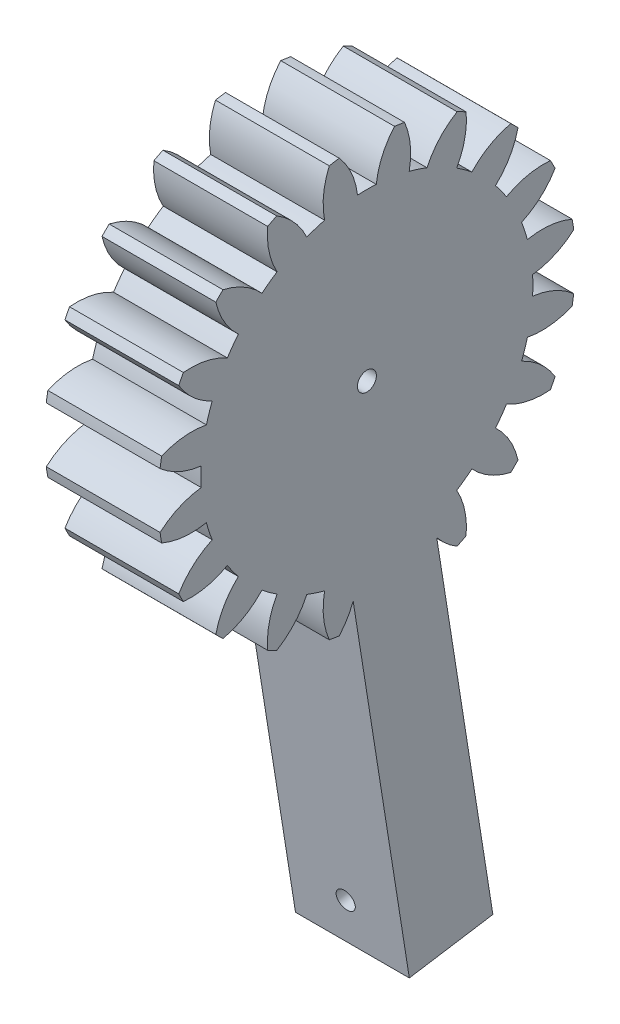
from build123d import *

# Parameters (mm, degrees)
BASPROSKE_W              = 30
BASPROSKE_H              = 55
TOOTHCUT_DEPTH           = 84.366660003
TEETHCUTS_COUNT          = 20
BORSKE_R                 = 2.5
BORE_DEPTH               = 50.0000508
EXTRUDE_1_DEPTH          = 30
CUT_EXTRUDE_1_DEPTH      = 158.555338193
CUT_EXTRUDE_1_DEPTH_BACK = 158.555338193
SKETCH_7_R               = 2.5


with BuildPart() as part:
    # BasProSke → Base-Revolve (revolve)
    with BuildSketch(Plane(origin=(0, 0, 0), x_dir=(1, 0, 0), z_dir=(0, 1, 0)), mode=Mode.PRIVATE) as base_revolve_sk:
        with Locations((15, 27.5)):
            Rectangle(BASPROSKE_W, BASPROSKE_H)
    revolve(base_revolve_sk.sketch.rotate(Axis((-10, 0, 0), (1, 0, 0)), 180), axis=Axis((-10, 0, 0), (1, 0, 0)))

    # TooCutSke → ToothCut (cut, through all)
    with BuildSketch(Plane(origin=(0, 0, 0), x_dir=(0, 0, -1), z_dir=(1, 0, 0))):
        with BuildLine():
            ThreePointArc((2.464838288, 43.679509764), (0, 43.749), (-2.464838288, 43.679509764))
            ThreePointArc((-2.464838288, 43.679509764), (-4.057398861, 49.476814676), (-7.300899231, 54.538899105))
            ThreePointArc((-7.300899231, 54.538899105), (0, 55.0254), (7.300899231, 54.538899105))
            ThreePointArc((7.300899231, 54.538899105), (4.057398861, 49.476814676), (2.464838288, 43.679509764))
        make_face()
    toothcut = extrude(amount=TOOTHCUT_DEPTH, mode=Mode.SUBTRACT)

    # TeethCuts: ToothCut ×20 about axis
    teethcuts_axis = Axis((0, 0, 0), (1, 0, 0))
    for i in range(1, TEETHCUTS_COUNT):
        add(toothcut.rotate(teethcuts_axis, i * 360 / TEETHCUTS_COUNT), mode=Mode.SUBTRACT)

    # BorSke → Bore (cut, symmetric)
    with BuildSketch(Plane(origin=(0, 0, 0), x_dir=(0, 0, -1), z_dir=(1, 0, 0))):
        with Locations(Location((0, 0, 0), (0, 0, 180))):
            Circle(BORSKE_R)
    extrude(amount=BORE_DEPTH, both=True, mode=Mode.SUBTRACT)

    # 草图6 → 凸台-拉伸1 (add)
    with BuildSketch(Plane(origin=(30, 0, 0), x_dir=(0, 0, -1), z_dir=(1, 0, 0))):
        with BuildLine():
            Line((-4.466100318, -43.081201999), (11.177346186, -141.850036058))
            Line((11.177346186, -141.850036058), (33.20378387, -138.361391053))
            Line((33.20378387, -138.361391053), (17.560337366, -39.592556994))
            ThreePointArc((17.560337366, -39.592556994), (6.77314241, -42.763938152), (-4.466100318, -43.081201999))
        make_face()
    extrude(amount=-EXTRUDE_1_DEPTH)

    # 草图7 → 切除-拉伸1 (cut, two sides: drawn at the far end of the back side and taken through both)
    with BuildSketch(Plane(origin=(0, -1.744322502, 11.013218842), x_dir=(1, 0, 0), z_dir=(0, -0.15643446504023845, 0.9876883405951365)).offset(-CUT_EXTRUDE_1_DEPTH_BACK)):
        with Locations(Location((15, -130.568148899, 0), (0, 0, 270))):
            Circle(SKETCH_7_R)
    extrude(amount=CUT_EXTRUDE_1_DEPTH + CUT_EXTRUDE_1_DEPTH_BACK, mode=Mode.SUBTRACT)


solid = part.part
